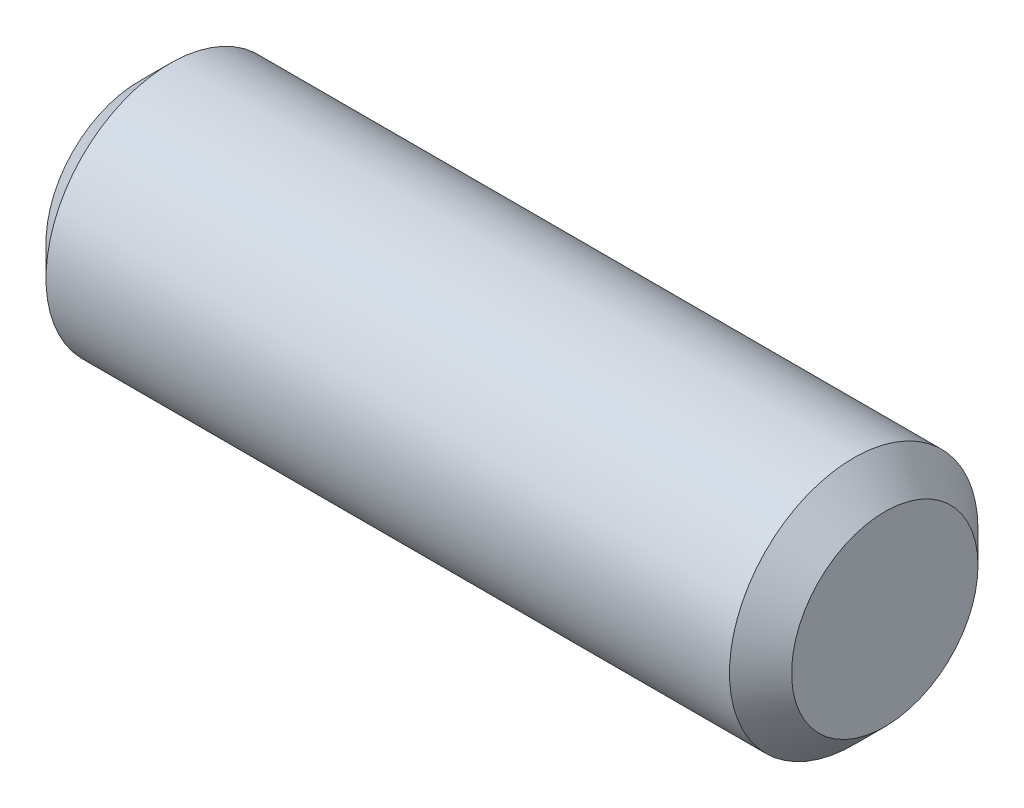
from build123d import *

# Parameters (mm, degrees)
EXTRUDE_1_DEPTH      = 12
EXTRUDE_1_DEPTH_BACK = 12
SKETCH_1_R           = 4
CHAMFER_1_SIZE       = 1


with BuildPart() as part:
    # 草圖1 → 擠出1 (new, two sides: drawn at the far end of the back side and taken through both)
    with BuildSketch(Plane.YZ.offset(-EXTRUDE_1_DEPTH_BACK)):
        with Locations(Location((0, 0, 0), (0, 0, 270))):
            Circle(SKETCH_1_R)
    extrude(amount=EXTRUDE_1_DEPTH + EXTRUDE_1_DEPTH_BACK)

    # 倒角1
    chamfer_1_edges = [part.edges().sort_by_distance(p)[0] for p in [
        (-12, 0, 4),
        (12, 0, 4),
    ]]
    chamfer(chamfer_1_edges, length=CHAMFER_1_SIZE)


solid = part.part
